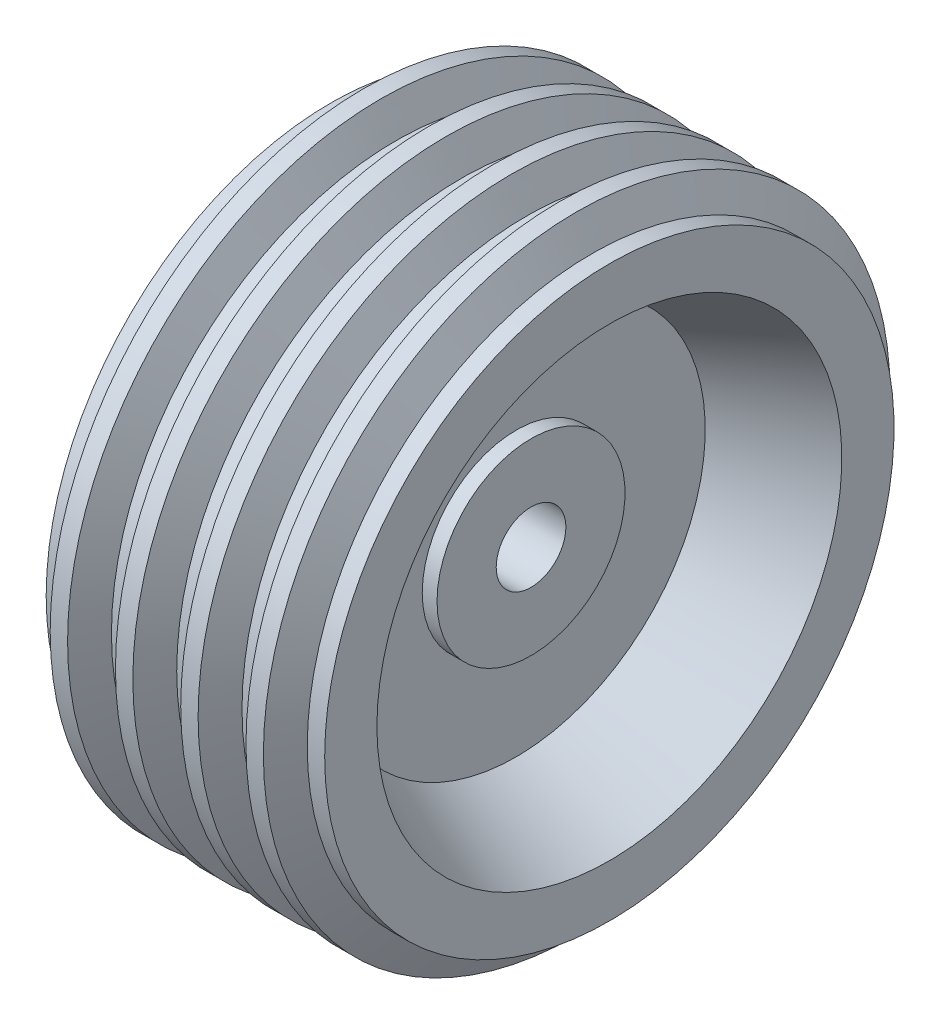
from build123d import *


with BuildPart() as part:
    # Sketch1 → Revolve2 (revolve)
    with BuildSketch(Plane.XY, mode=Mode.PRIVATE) as revolve2_sk:
        Polygon((-35, 20), (-35, 54), (-26.5, 54), (-26.5, 108.596183719), (-80, 133.54364343), (-80, 163.54364343), (-69.991642542, 163.54364343), (-61.241642543, 180), (-51.241642542, 180), (-42.500000003, 163.54364343), (-32.500000001, 163.54364343), (-23.750000002, 180), (-13.75, 180), (-5.000000001, 163.54364343), (5.000000001, 163.54364343), (13.75, 180), (23.750000002, 180), (32.500000001, 163.54364343), (42.500000003, 163.54364343), (51.241642542, 180), (61.241642543, 180), (69.991642542, 163.54364343), (80, 163.54364343), (80, 133.54364343), (26.5, 108.596183719), (26.5, 54), (35, 54), (35, 20), align=None)
    revolve(revolve2_sk.sketch.rotate(Axis((-35, 0, 0), (1, 0, 0)), 90), axis=Axis((-35, 0, 0), (1, 0, 0)))


solid = part.part
